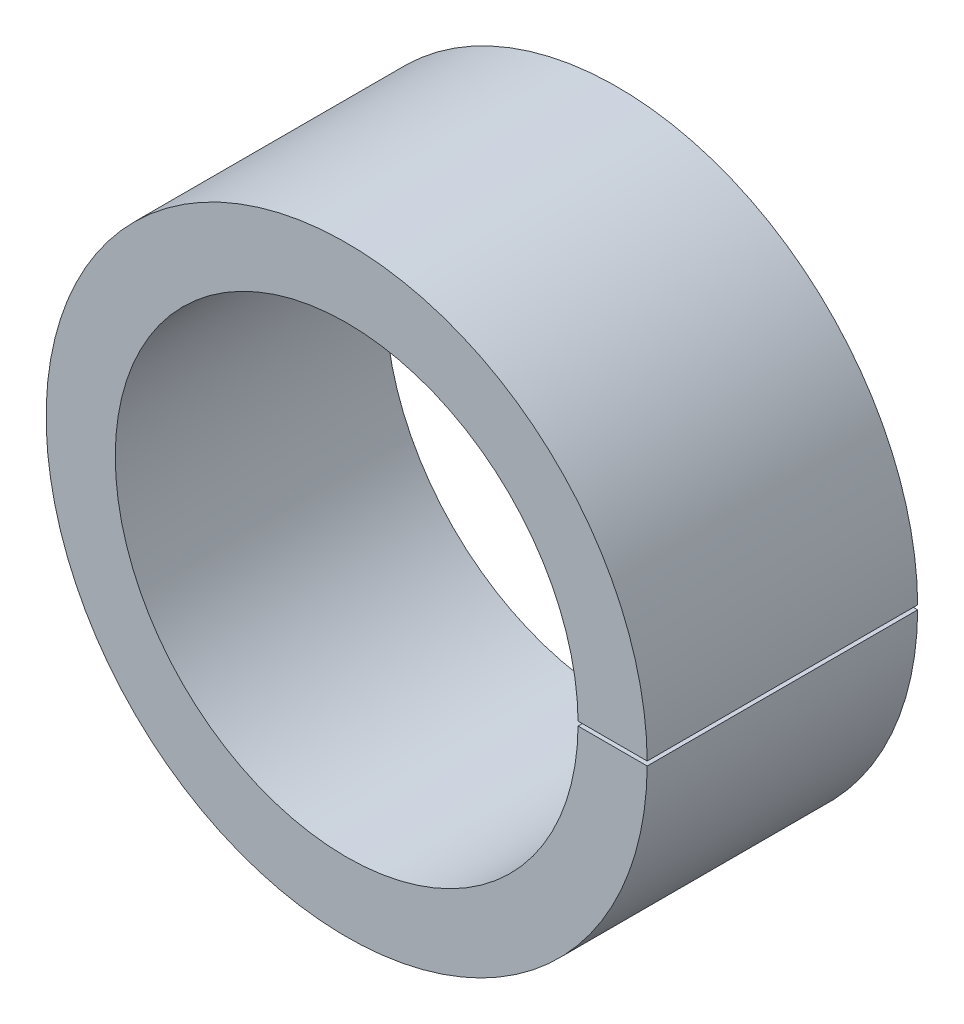
from build123d import *

# Parameters (mm, degrees)
BOSS_EXTRUDE1_DEPTH      = 4.7625
BOSS_EXTRUDE1_DEPTH_BACK = 4.7625
SKETCH4_W                = 24.044105213
SKETCH4_H                = 22.52166187
CUT_EXTRUDE1_DEPTH       = 3.81


with BuildPart() as part:
    # Sketch3 → Boss-Extrude1 (new, two sides: drawn at the far end of the back side and taken through both)
    with BuildSketch(Plane.XY.offset(-BOSS_EXTRUDE1_DEPTH_BACK)):
        with BuildLine():
            Line((4.889292919, 0.045), (6.349840549, 0.045))
            ThreePointArc((6.349840549, 0.045), (-6.35, 0), (6.349840549, -0.045))
            Line((6.349840549, -0.045), (4.889292919, -0.045))
            ThreePointArc((4.889292919, -0.045), (-4.8895, 0), (4.889292919, 0.045))
        make_face()
    extrude(amount=BOSS_EXTRUDE1_DEPTH + BOSS_EXTRUDE1_DEPTH_BACK)

    # Sketch4 → Cut-Extrude1 (cut)
    with BuildSketch(Plane(origin=(0, 0, -4.7625), x_dir=(-1, 0, 0), z_dir=(0, 0, -1))):
        with Locations((-0.7086439, 0.118120604)):
            Rectangle(SKETCH4_W, SKETCH4_H)
    extrude(amount=-CUT_EXTRUDE1_DEPTH, mode=Mode.SUBTRACT)


solid = part.part
